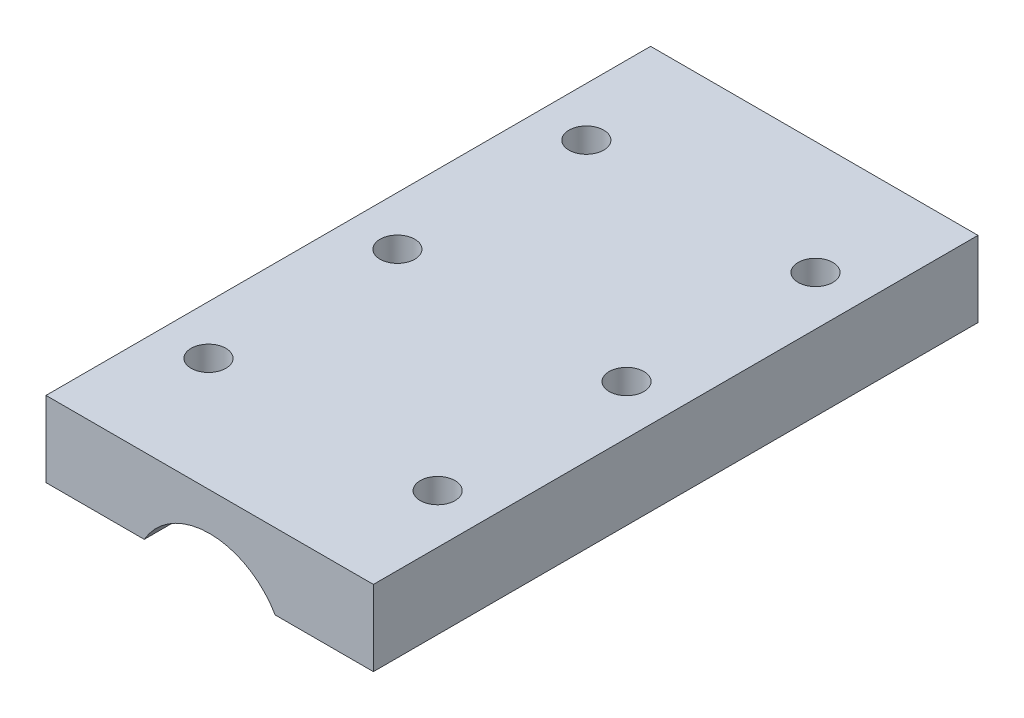
from build123d import *

# Parameters (mm, degrees)
SKETCH_1_W          = 21.66025404
SKETCH_1_H          = 40
EXTRUDE_1_DEPTH     = 5
CUT_EXTRUDE_1_DEPTH = 40
SKETCH_3_R          = 1.15
CUT_EXTRUDE_2_DEPTH = 5


with BuildPart() as part:
    # Эскиз1 → Бобышка-Вытянуть1 (new body)
    with BuildSketch(Plane(origin=(0, 0, 0), x_dir=(1, 0, 0), z_dir=(0, 1, 0))):
        Rectangle(SKETCH_1_W, SKETCH_1_H)
    extrude(amount=EXTRUDE_1_DEPTH)

    # Эскиз2 → Вырез-Вытянуть1 (cut)
    with BuildSketch(Plane.XY.offset(20)):
        with BuildLine():
            Line((-4.33012702, 0), (4.33012702, 0))
            ThreePointArc((4.33012702, 0), (0, 2.500000002), (-4.33012702, 0))
        make_face()
    extrude(amount=-CUT_EXTRUDE_1_DEPTH, mode=Mode.SUBTRACT)

    # Эскиз3 → Вырез-Вытянуть2 (cut)
    with BuildSketch(Plane.XZ):
        with Locations(Location((7.58012702, 12.5, 0), (0, 0, 270))):
            Circle(SKETCH_3_R)
        with Locations(Location((7.58012702, -12.5, 0), (0, 0, 270))):
            Circle(SKETCH_3_R)
        with Locations(Location((7.58012702, 0, 0), (0, 0, 270))):
            Circle(SKETCH_3_R)
        with Locations(Location((-7.58012702, -12.5, 0), (0, 0, 270))):
            Circle(SKETCH_3_R)
        with Locations(Location((-7.58012702, 0, 0), (0, 0, 270))):
            Circle(SKETCH_3_R)
        with Locations(Location((-7.58012702, 12.5, 0), (0, 0, 270))):
            Circle(SKETCH_3_R)
    extrude(amount=-CUT_EXTRUDE_2_DEPTH, mode=Mode.SUBTRACT)


solid = part.part
